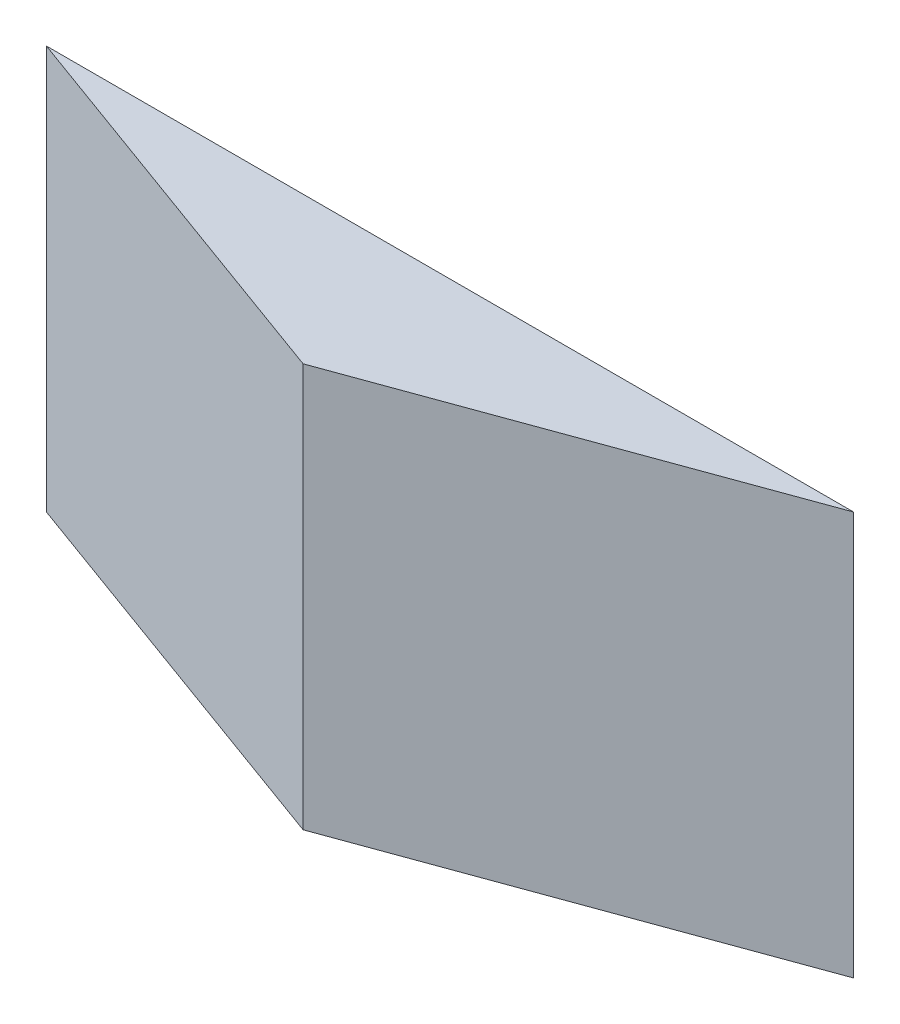
from build123d import *

# Parameters (mm, degrees)
BOSS_EXTRUDE1_DEPTH = 20


with BuildPart() as part:
    # Sketch1 → Boss-Extrude1 (new body)
    with BuildSketch(Plane(origin=(0, 0, 0), x_dir=(1, 0, 0), z_dir=(0, 1, 0))):
        Polygon((-20, 0), (20, 0), (0, -7.279404685), align=None)
    extrude(amount=BOSS_EXTRUDE1_DEPTH)


solid = part.part
